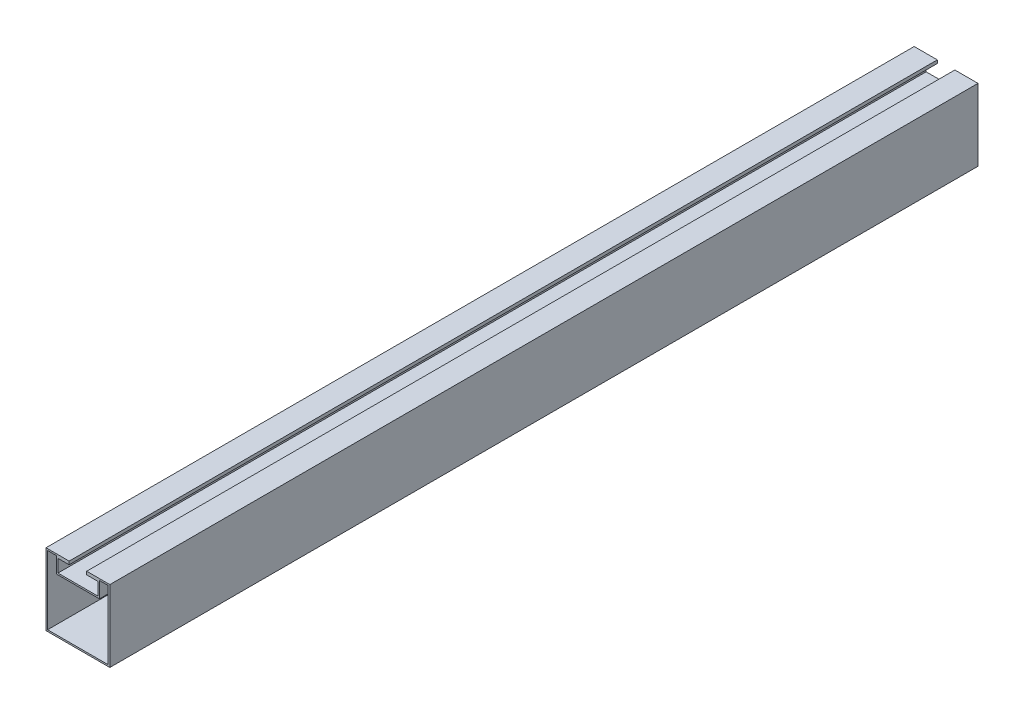
from build123d import *

# Parameters (mm, degrees)
BOSS_EXTRUDE1_DEPTH = 550
SKETCH2_R           = 3
CUT_EXTRUDE2_DEPTH  = 200
SKETCH3_W           = 47.285738773
SKETCH3_H           = 54.700142613
CUT_EXTRUDE3_DEPTH  = 6


with BuildPart() as part:
    # Sketch1 → Boss-Extrude1 (new body)
    with BuildSketch(Plane.XY):
        Polygon((25.5, 43), (25.5, 45), (40, 45), (40, 0), (0, 0), (0, 45), (14.5, 45), (14.5, 43), (9.595309941, 43), (7.5, 43), (7.5, 35), (32.5, 35), (32.5, 43), align=None)
        Polygon((33.5, 44), (33.5, 34), (6.5, 34), (6.5, 44), (1, 44), (1, 1), (39, 1), (39, 44), align=None, mode=Mode.SUBTRACT)
    extrude(amount=BOSS_EXTRUDE1_DEPTH)

    # Sketch2 → Cut-Extrude2 (cut)
    with BuildSketch(Plane(origin=(0, 35, 0), x_dir=(1, 0, 0), z_dir=(0, 1, 0))):
        with Locations(Location((20, -40, 0), (0, 0, 180))):
            Circle(SKETCH2_R)
        with Locations(Location((20, -510, 0), (0, 0, 180))):
            Circle(SKETCH2_R)
    extrude(amount=-CUT_EXTRUDE2_DEPTH, mode=Mode.SUBTRACT)

    # Sketch3 → Cut-Extrude3 (cut)
    with BuildSketch(Plane(origin=(0, 0, 0), x_dir=(-1, 0, 0), z_dir=(0, 0, -1))):
        with Locations((-18.970719089, 19.421785252)):
            Rectangle(SKETCH3_W, SKETCH3_H)
    extrude(amount=-CUT_EXTRUDE3_DEPTH, mode=Mode.SUBTRACT)


solid = part.part
